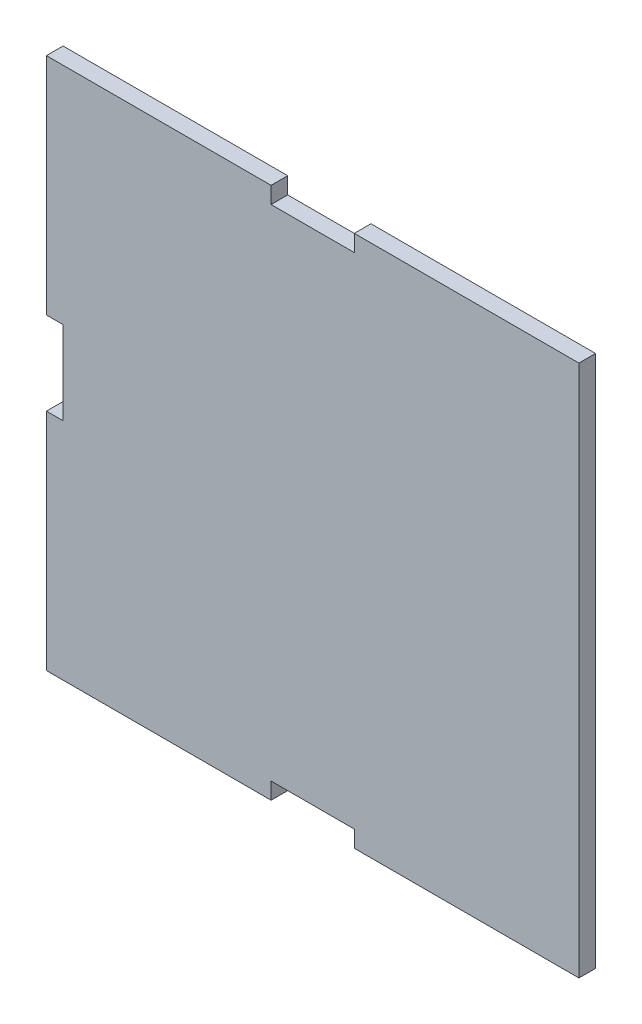
from build123d import *

# Parameters (mm, degrees)
EXTRUDE_1_DEPTH = 2


with BuildPart() as part:
    # 草图1 → 凸台-拉伸1 (new body)
    with BuildSketch(Plane.XY):
        Polygon((16.974358974, 15.205128205), (16.974358974, 42.205128205), (2.974358974, 42.205128205), (-5.298152288, 42.205128205), (-10.025641026, 42.205128205), (-10.025641026, 40.205128205), (-20.025641026, 40.205128205), (-20.025641026, 42.205128205), (-47.025641026, 42.205128205), (-47.025641026, 15.205128205), (-45.025641026, 15.205128205), (-45.025641026, 5.205128205), (-47.025641026, 5.205128205), (-47.025641026, -21.794871795), (-20.025641026, -21.794871795), (-20.025641026, -19.794871795), (-10.025641026, -19.794871795), (-10.025641026, -21.794871795), (16.974358974, -21.794871795), (16.974358974, 5.205128205), align=None)
    extrude(amount=EXTRUDE_1_DEPTH)


solid = part.part
